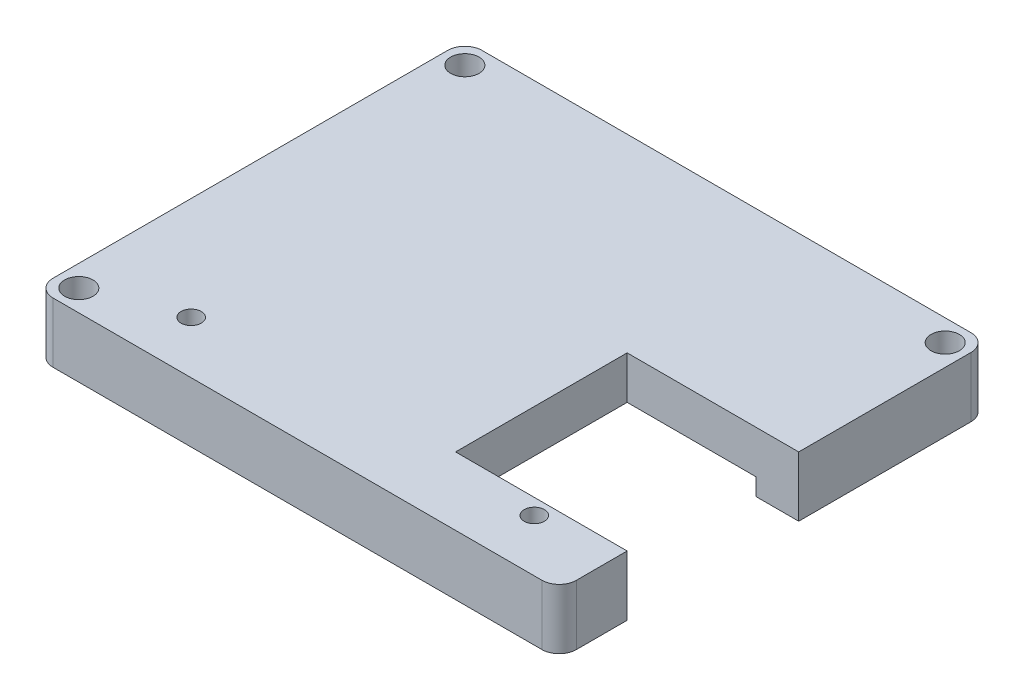
from build123d import *

# Parameters (mm, degrees)
SKETCH1_W           = 77.47
SKETCH1_H           = 63.5
BOSS_EXTRUDE1_DEPTH = 6.35
SKETCH1_3_W         = 77.47
SKETCH1_3_H         = 63.5
SKETCH1_3_W_2       = 64.77
SKETCH1_3_H_2       = 50.8
BOSS_EXTRUDE2_DEPTH = 2.54
SKETCH2_W           = 25.4
SKETCH2_H           = 25.4
CUT_EXTRUDE1_DEPTH  = 12.7
SKETCH3_R           = 2.1
CUT_EXTRUDE2_DEPTH  = 12.7
FILLET1_R           = 2.54
SKETCH4_R           = 1.5
CUT_EXTRUDE3_DEPTH  = 22.86


with BuildPart() as part:
    # Sketch1 → Boss-Extrude1 (new body)
    with BuildSketch(Plane(origin=(0, 0, 0), x_dir=(1, 0, 0), z_dir=(0, 1, 0))):
        with Locations((32.385, 26.545081967)):
            Rectangle(SKETCH1_W, SKETCH1_H)
    extrude(amount=BOSS_EXTRUDE1_DEPTH)

    # Sketch1<3> → Boss-Extrude2 (add)
    with BuildSketch(Plane(origin=(0, 0, 0), x_dir=(1, 0, 0), z_dir=(0, 1, 0))):
        with Locations((32.385, 26.545081967)):
            Rectangle(SKETCH1_3_W, SKETCH1_3_H)
        with Locations((32.385, 25.4)):
            Rectangle(SKETCH1_3_W_2, SKETCH1_3_H_2, mode=Mode.SUBTRACT)
    extrude(amount=-BOSS_EXTRUDE2_DEPTH)

    # Sketch2 → Cut-Extrude1 (cut)
    with BuildSketch(Plane.XZ.offset(2.54)):
        with Locations((58.42, -17.556565957)):
            Rectangle(SKETCH2_W, SKETCH2_H)
    extrude(amount=-CUT_EXTRUDE1_DEPTH, mode=Mode.SUBTRACT)

    # Sketch3 → Cut-Extrude2 (cut)
    with BuildSketch(Plane.XZ.offset(2.54)):
        with Locations((-3.175, 2.029918033)):
            Circle(SKETCH3_R)
        with Locations((-3.175, -55.120081967)):
            Circle(SKETCH3_R)
        with Locations((67.945, -55.120081967)):
            Circle(SKETCH3_R)
    extrude(amount=-CUT_EXTRUDE2_DEPTH, mode=Mode.SUBTRACT)

    # Fillet1
    fillet1_edges = [part.edges().sort_by_distance(p)[0] for p in [
        (-6.35, 1.905, -58.295081967),
        (71.12, 1.905, -58.295081967),
        (71.12, 1.905, 5.204918033),
        (-6.35, 1.905, 5.204918033),
    ]]
    fillet(fillet1_edges, radius=FILLET1_R)

    # Sketch4 → Cut-Extrude3 (cut)
    with BuildSketch(Plane.XZ):
        with Locations((59.69, -2.54)):
            Circle(SKETCH4_R)
        with Locations((8.89, -2.54)):
            Circle(SKETCH4_R)
    extrude(amount=-CUT_EXTRUDE3_DEPTH, mode=Mode.SUBTRACT)


solid = part.part
